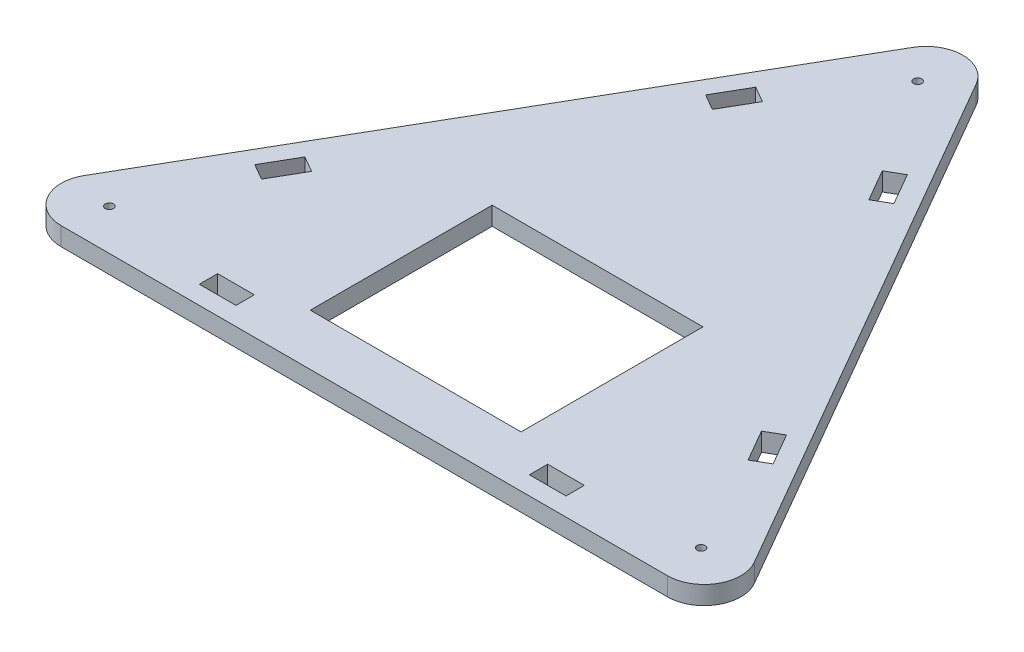
from build123d import *

# Parameters (mm, degrees)
BOSS_EXTRUDE1_DEPTH = 6.35
SKETCH2_W           = 36.5
SKETCH2_H           = 63
SKETCH2_R           = 1.4224
CUT_EXTRUDE2_DEPTH  = 195.099602868
FILLET1_R           = 12.7
SKETCH3_W           = 12.7
SKETCH3_H           = 6.35
CUT_EXTRUDE3_DEPTH  = 179.426731159


with BuildPart() as part:
    # Sketch1 → Boss-Extrude1 (new body)
    with BuildSketch(Plane(origin=(0, 0, 0), x_dir=(1, 0, 0), z_dir=(0, 1, 0))):
        Polygon((0, 146.646968374), (-127, -73.323484187), (127, -73.323484187), align=None)
    extrude(amount=BOSS_EXTRUDE1_DEPTH)

    # Sketch2 → Cut-Extrude2 (cut, through all)
    with BuildSketch(Plane(origin=(0, 6.35, 0), x_dir=(1, 0, 0), z_dir=(0, 1, 0))):
        with Locations((-18.25, -24.043484187)):
            Rectangle(SKETCH2_W, SKETCH2_H)
        with Locations((18.25, -24.043484187)):
            Rectangle(SKETCH2_W, SKETCH2_H)
        with Locations(Location((0, 118.312139176, 0), (0, 0, 270))):
            Circle(SKETCH2_R)
        with Locations(Location((-102.461318102, -59.156069588, 0), (0, 0, 270))):
            Circle(SKETCH2_R)
        with Locations(Location((102.461318102, -59.156069588, 0), (0, 0, 270))):
            Circle(SKETCH2_R)
    extrude(amount=-CUT_EXTRUDE2_DEPTH, mode=Mode.SUBTRACT)

    # Fillet1
    fillet1_edges = [part.edges().sort_by_distance(p)[0] for p in [
        (127, 3.175, 73.323484187),
        (-127, 3.175, 73.323484187),
        (0, 3.175, -146.646968374),
    ]]
    fillet(fillet1_edges, radius=FILLET1_R)

    # Sketch3 → Cut-Extrude3 (cut, through all)
    with BuildSketch(Plane(origin=(0, 6.35, 0), x_dir=(1, 0, 0), z_dir=(0, 1, 0))):
        Polygon((-26.250738686, 88.479355234), (-32.600738686, 77.480832606), (-27.101477372, 74.305832606), (-20.751477372, 85.304355234), align=None)
        Polygon((-77.901477372, -13.682348419), (-83.400738686, -10.507348419), (-89.750738686, -21.505871047), (-84.251477372, -24.680871047), align=None)
        with Locations((-57.15, -63.798484187)):
            Rectangle(SKETCH3_W, SKETCH3_H)
        with Locations((57.15, -63.798484187)):
            Rectangle(SKETCH3_W, SKETCH3_H)
        Polygon((89.750738686, -21.505871047), (83.400738686, -10.507348419), (77.901477372, -13.682348419), (84.251477372, -24.680871047), align=None)
        Polygon((27.101477372, 74.305832606), (32.600738686, 77.480832606), (26.250738686, 88.479355234), (20.751477372, 85.304355234), align=None)
    extrude(amount=-CUT_EXTRUDE3_DEPTH, mode=Mode.SUBTRACT)


solid = part.part
